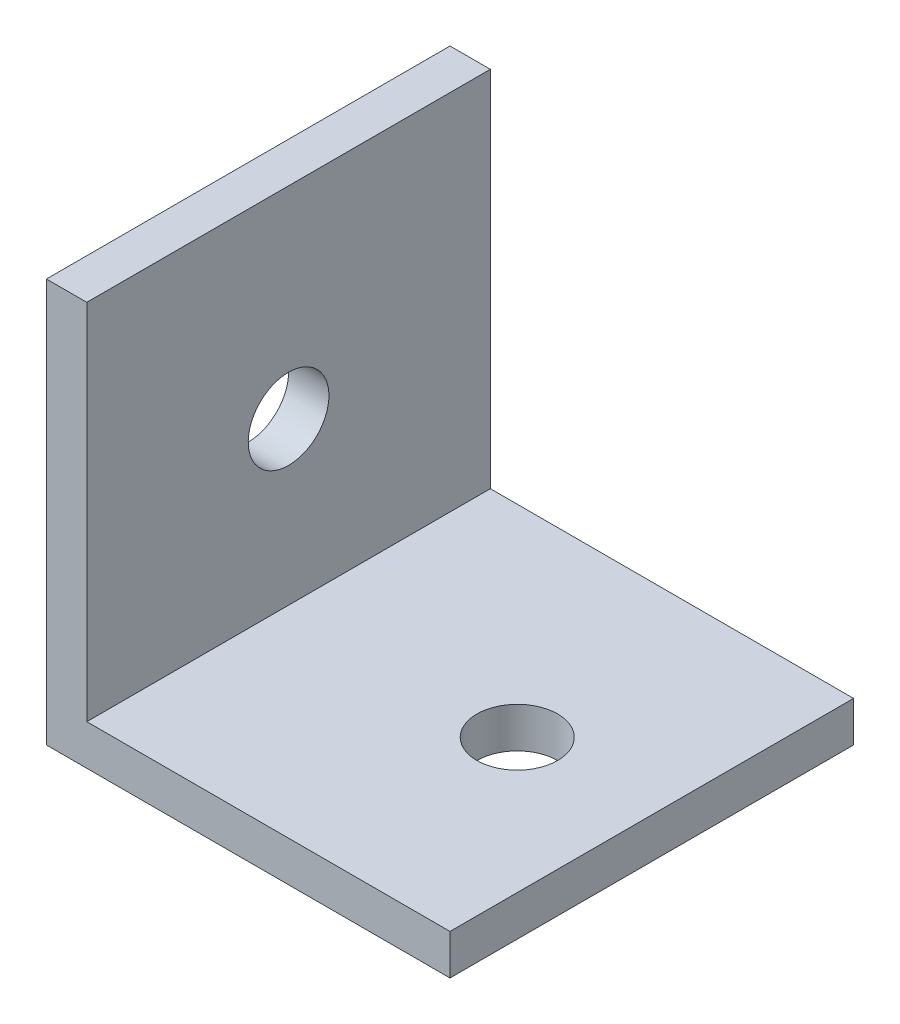
from build123d import *

# Parameters (mm, degrees)
EXTRUSION1_DEPTH = 15
ESQUISSE2_R      = 1.5
EXTRUSION2_DEPTH = 15
ESQUISSE3_R      = 1.5
EXTRUSION3_DEPTH = 15


with BuildPart() as part:
    # Esquisse1 → Extrusion1 (new body)
    with BuildSketch(Plane.XY):
        Polygon((-11.995707567, -0.631620023), (-11.995707567, -15.631620023), (3.004292433, -15.631620023), (3.004292433, -14.131620023), (-10.495707567, -14.131620023), (-10.495707567, -0.631620023), align=None)
    extrude(amount=EXTRUSION1_DEPTH)

    # Esquisse2 → Extrusion2 (cut)
    with BuildSketch(Plane.ZY.offset(11.995707567)):
        with Locations(Location((7.5, -8.131620023, 0), (0, 0, 270))):
            Circle(ESQUISSE2_R)
    extrude(amount=-EXTRUSION2_DEPTH, mode=Mode.SUBTRACT)

    # Esquisse3 → Extrusion3 (cut)
    with BuildSketch(Plane.XZ.offset(15.631620023)):
        with Locations(Location((-1.995707567, 7.5, 0), (0, 0, 270))):
            Circle(ESQUISSE3_R)
    extrude(amount=-EXTRUSION3_DEPTH, mode=Mode.SUBTRACT)


solid = part.part
